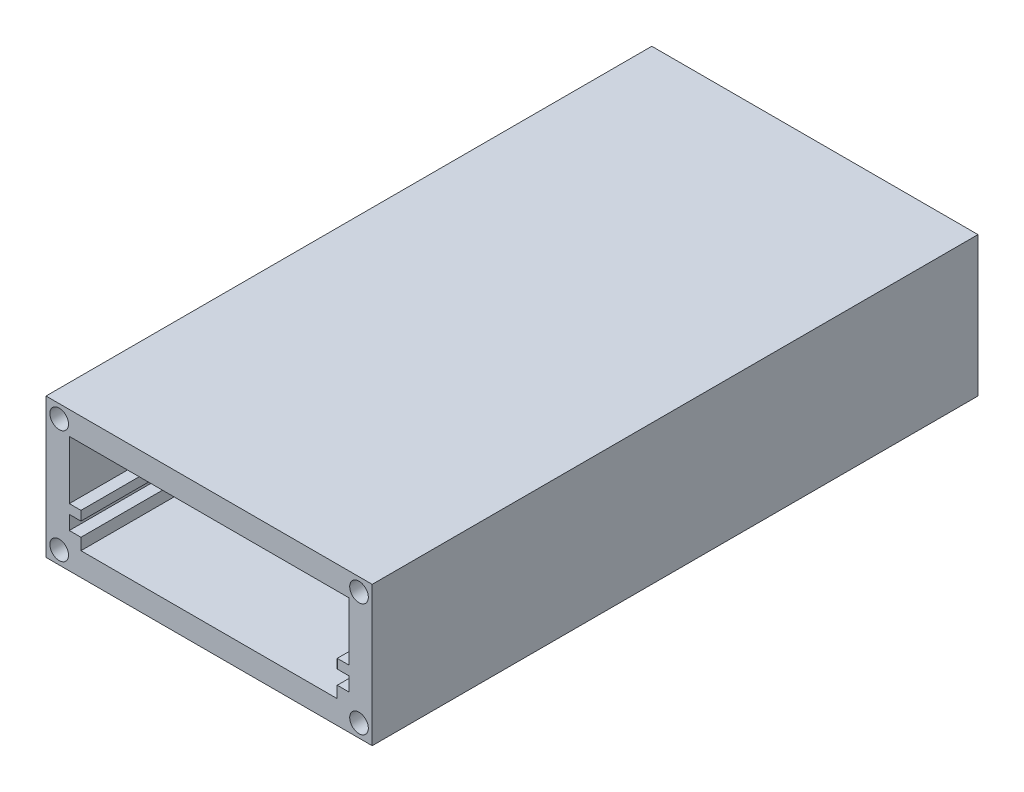
from build123d import *

# Parameters (mm, degrees)
BOSS_EXTRUDE2_DEPTH = 30
CUT_EXTRUDE1_DEPTH  = 125
SKETCH4_W           = 125
SKETCH4_H           = 2
SKETCH4_H_2         = 2.5
BOSS_EXTRUDE4_DEPTH = 2.5
SKETCH5_W           = 125
SKETCH5_H           = 2.5
SKETCH5_H_2         = 2
BOSS_EXTRUDE5_DEPTH = 2.5
SKETCH6_R           = 2
CUT_EXTRUDE2_DEPTH  = 20


with BuildPart() as part:
    # Sketch1 → Boss-Extrude2 (new body)
    with BuildSketch(Plane(origin=(0, 0, 0), x_dir=(1, 0, 0), z_dir=(0, 1, 0))):
        Polygon((-5, 130), (-5, 0), (0, 0), (65, 0), (65, 130), align=None)
    extrude(amount=BOSS_EXTRUDE2_DEPTH)

    # Sketch3 → Cut-Extrude1 (cut)
    with BuildSketch(Plane.XY):
        Polygon((24.738126678, 25), (0, 25), (0, 5), (60, 5), (60, 25), align=None)
    extrude(amount=-CUT_EXTRUDE1_DEPTH, mode=Mode.SUBTRACT)

    # Sketch4 → Boss-Extrude4 (add)
    with BuildSketch(Plane(origin=(0, 0, 0), x_dir=(0, 0, -1), z_dir=(1, 0, 0))):
        with Locations((62.5, 11.5)):
            Rectangle(SKETCH4_W, SKETCH4_H)
        with Locations((62.5, 6.25)):
            Rectangle(SKETCH4_W, SKETCH4_H_2)
    extrude(amount=BOSS_EXTRUDE4_DEPTH)

    # Sketch5 → Boss-Extrude5 (add)
    with BuildSketch(Plane.ZY.offset(-60)):
        with Locations((-62.5, 6.25)):
            Rectangle(SKETCH5_W, SKETCH5_H)
        with Locations((-62.5, 11.5)):
            Rectangle(SKETCH5_W, SKETCH5_H_2)
    extrude(amount=BOSS_EXTRUDE5_DEPTH)

    # Sketch6 → Cut-Extrude2 (cut)
    with BuildSketch(Plane.XY):
        with Locations((-2.171572875, 27.171572875)):
            Circle(SKETCH6_R)
        with Locations((62.171572875, 27.171572875)):
            Circle(SKETCH6_R)
        with Locations((62.171572875, 2.828427125)):
            Circle(SKETCH6_R)
        with Locations((-2.171572875, 2.828427125)):
            Circle(SKETCH6_R)
    extrude(amount=-CUT_EXTRUDE2_DEPTH, mode=Mode.SUBTRACT)


solid = part.part
